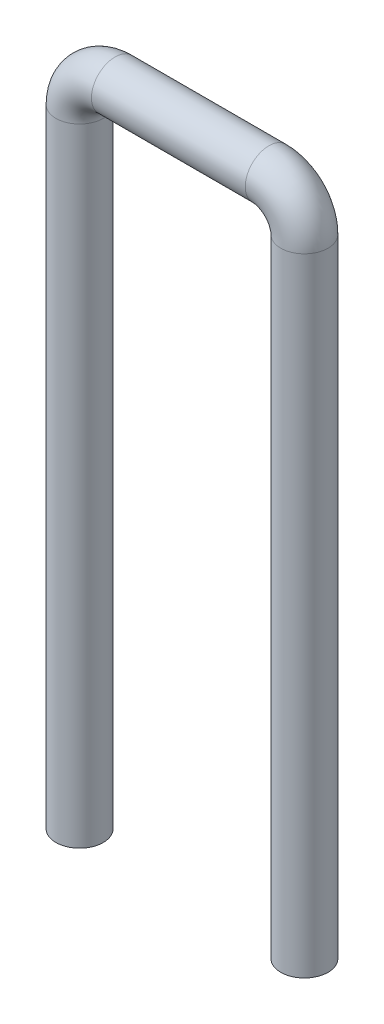
from build123d import *

# Parameters (mm, degrees)
ESQUISSE2_R = 2


with BuildPart() as part:
    # Balayage1: sweep along a path in Esquisse1
    with BuildLine(Plane.XY) as balayage1_path:
        Line((0, 0), (0, 53))
        ThreePointArc((0, 53), (0.878679656, 55.121320344), (3, 56))
        Line((3, 56), (16, 56))
        ThreePointArc((16, 56), (18.121320344, 55.121320344), (19, 53))
        Line((19, 53), (19, 0))
    # Esquisse2 → Balayage1 (sweep)
    with BuildSketch(Plane(origin=(0, 0, 0), x_dir=(1, 0, 0), z_dir=(0, 1, 0))):
        Circle(ESQUISSE2_R)
    sweep(path=balayage1_path.line)


solid = part.part
